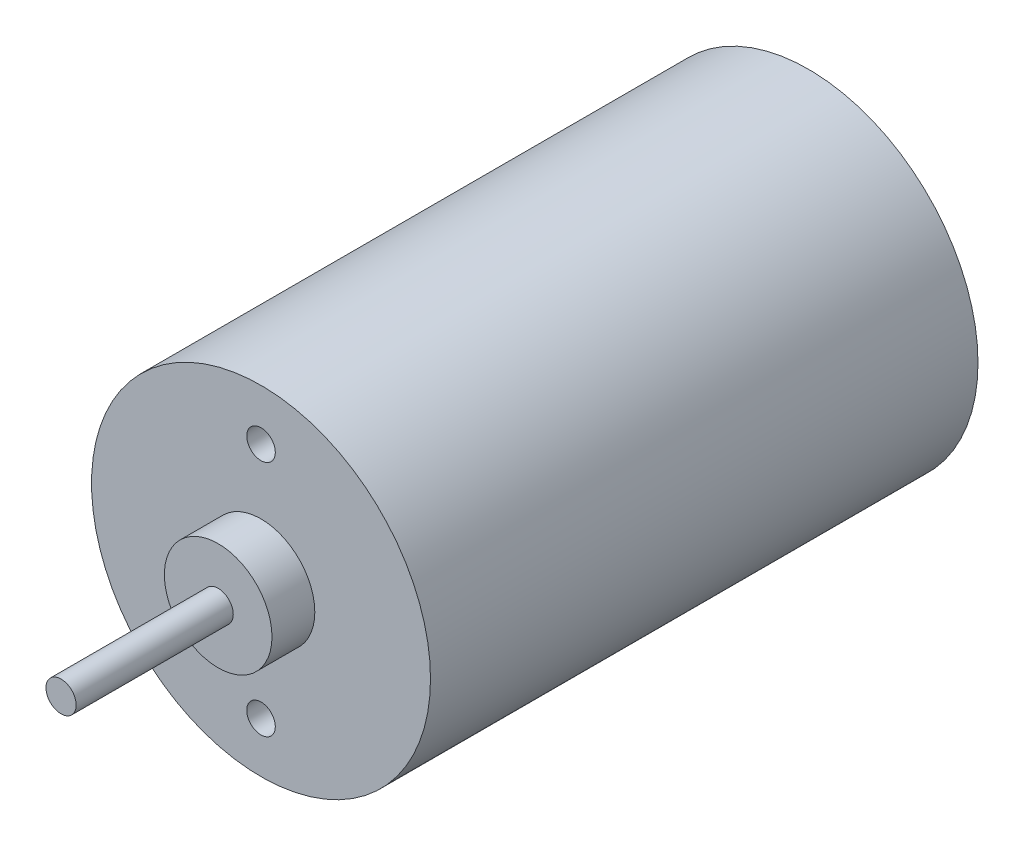
from build123d import *

# Parameters (mm, degrees)
SKETCH1_R                    = 17.8
BOSS_EXTRUDE1_DEPTH          = 57.5
SKETCH2_R                    = 5.65
BOSS_EXTRUDE2_DEPTH          = 4.5
SKETCH3_R                    = 1.585
BOSS_EXTRUDE3_DEPTH          = 16.5
F_3_0_3_DIAMETER_HOLE1_D     = 3
F_3_0_3_DIAMETER_HOLE1_DEPTH = 6.35
F_3_0_3_DIAMETER_HOLE1_TIP   = 0.901290929


with BuildPart() as part:
    # Sketch1 → Boss-Extrude1 (new body)
    with BuildSketch(Plane.XY):
        Circle(SKETCH1_R)
    extrude(amount=BOSS_EXTRUDE1_DEPTH)

    # Sketch2 → Boss-Extrude2 (add)
    with BuildSketch(Plane.XY.offset(57.5)):
        Circle(SKETCH2_R)
    extrude(amount=BOSS_EXTRUDE2_DEPTH)

    # Sketch3 → Boss-Extrude3 (add)
    with BuildSketch(Plane.XY.offset(62)):
        Circle(SKETCH3_R)
    extrude(amount=BOSS_EXTRUDE3_DEPTH)

    # Ø3.0 (3) Diameter Hole1
    with Locations(Plane.XY.offset(57.5)):
        with Locations((0, 12.446), (0, -12.5)):
            Hole(F_3_0_3_DIAMETER_HOLE1_D / 2, depth=F_3_0_3_DIAMETER_HOLE1_DEPTH)
            with Locations((0, 0, -(F_3_0_3_DIAMETER_HOLE1_DEPTH + F_3_0_3_DIAMETER_HOLE1_TIP / 2))):  # 118° drill point
                Cone(0, F_3_0_3_DIAMETER_HOLE1_D / 2, F_3_0_3_DIAMETER_HOLE1_TIP, mode=Mode.SUBTRACT)


solid = part.part
